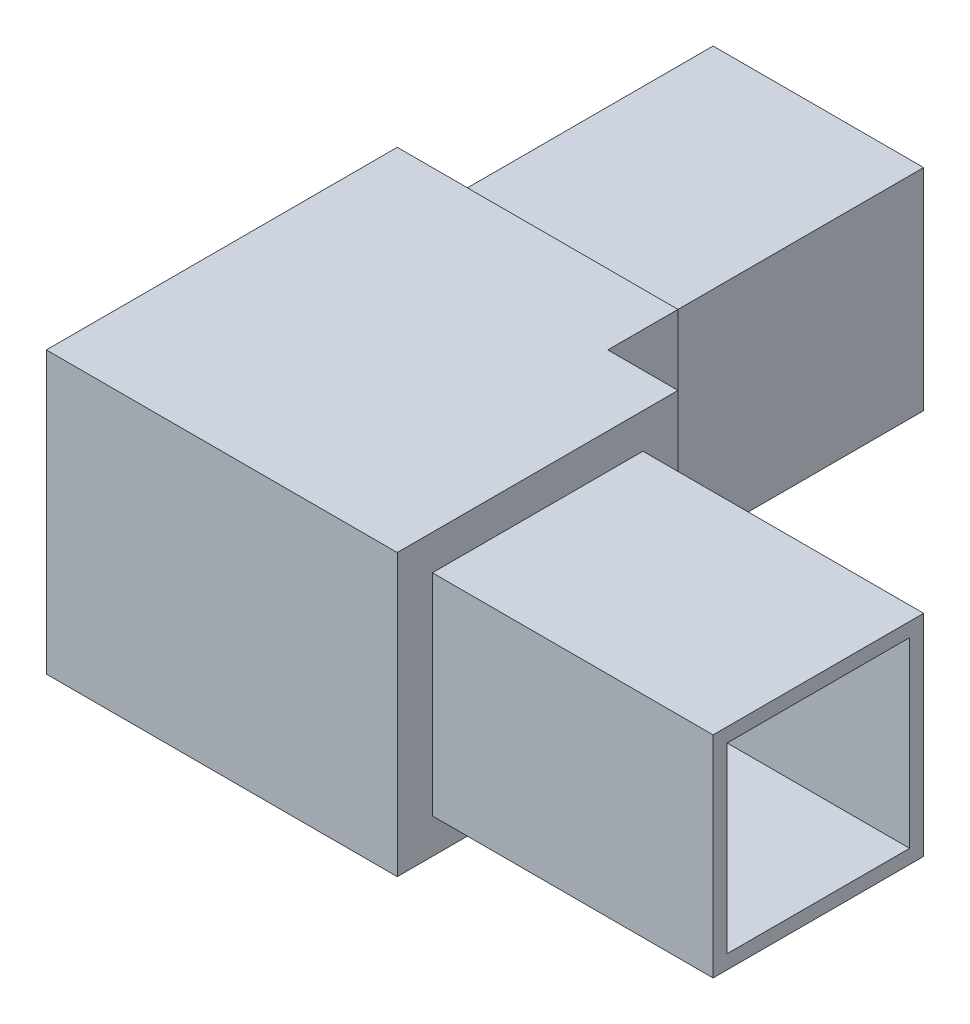
from build123d import *

# Parameters (mm, degrees)
CROQUIS1_W     = 40
CROQUIS1_H     = 50
CROQUIS1_H_2   = 40
CROQUIS1_W_2   = 50
EXTRUIR1_DEPTH = 40
CROQUIS2_W     = 40
CROQUIS2_H     = 40
CROQUIS2_W_2   = 30
CROQUIS2_H_2   = 30
EXTRUIR2_DEPTH = 40
CROQUIS3_W     = 40
CROQUIS3_H     = 40
CROQUIS3_W_2   = 30
CROQUIS3_H_2   = 30
EXTRUIR3_DEPTH = 40
VACIADO1_T     = -2


with BuildPart() as part:
    # Croquis1 → Extruir1 (new body)
    with BuildSketch(Plane(origin=(0, 0, 0), x_dir=(1, 0, 0), z_dir=(0, 1, 0))):
        with Locations((0, 45)):
            Rectangle(CROQUIS1_W, CROQUIS1_H)
        Rectangle(CROQUIS1_W, CROQUIS1_H_2)
        with Locations((45, 0)):
            Rectangle(CROQUIS1_W_2, CROQUIS1_H_2)
    extrude(amount=EXTRUIR1_DEPTH)

    # Croquis2 → Extruir2 (cut)
    with BuildSketch(Plane(origin=(70, 0, 0), x_dir=(0, 0, -1), z_dir=(1, 0, 0))):
        with Locations((0, 20)):
            Rectangle(CROQUIS2_W, CROQUIS2_H)
        with Locations((0, 20)):
            Rectangle(CROQUIS2_W_2, CROQUIS2_H_2, mode=Mode.SUBTRACT)
    extrude(amount=-EXTRUIR2_DEPTH, mode=Mode.SUBTRACT)

    # Croquis3 → Extruir3 (cut)
    with BuildSketch(Plane(origin=(0, 0, -70), x_dir=(-1, 0, 0), z_dir=(0, 0, -1))):
        with Locations((0, 20)):
            Rectangle(CROQUIS3_W, CROQUIS3_H)
        with Locations((0, 20)):
            Rectangle(CROQUIS3_W_2, CROQUIS3_H_2, mode=Mode.SUBTRACT)
    extrude(amount=-EXTRUIR3_DEPTH, mode=Mode.SUBTRACT)

    # Vaciado1
    vaciado1_openings = [part.faces().sort_by_distance(p)[0] for p in [
        (70, 20, 0),
        (0, 20, -70),
    ]]
    offset(amount=VACIADO1_T, openings=vaciado1_openings, kind=Kind.INTERSECTION)


solid = part.part
